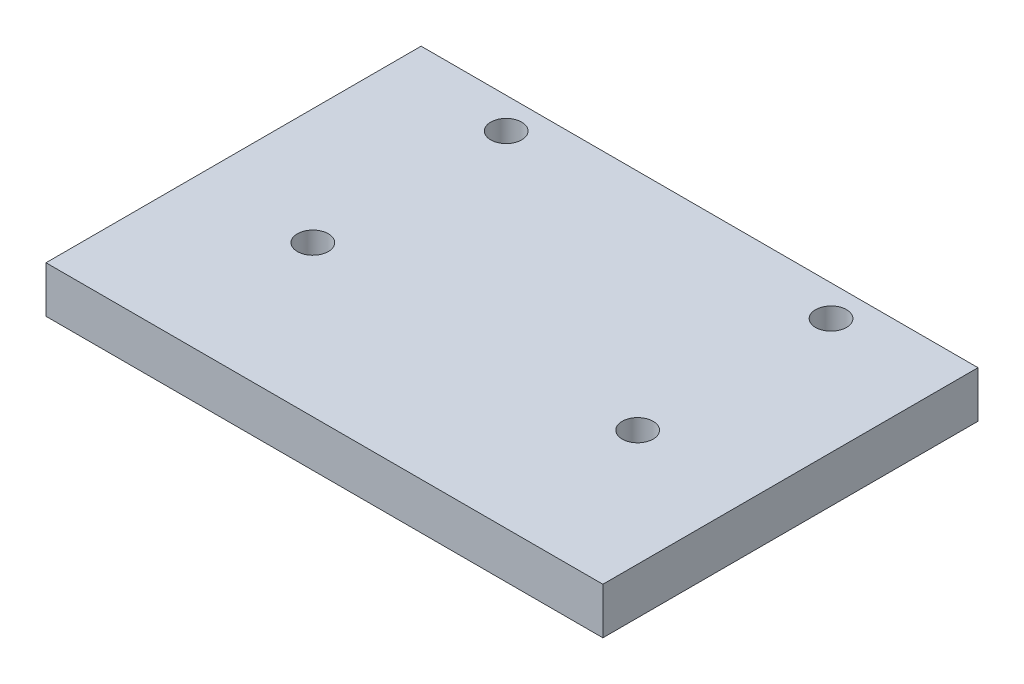
from build123d import *

# Parameters (mm, degrees)
SKETCH2_W           = 36
SKETCH2_H           = 24.25
SKETCH2_R           = 1
BOSS_EXTRUDE1_DEPTH = 3


with BuildPart() as part:
    # Sketch2 → Boss-Extrude1 (new body)
    with BuildSketch(Plane(origin=(0, 0, 0), x_dir=(1, 0, 0), z_dir=(0, 1, 0))):
        with Locations((18, 12.125)):
            Rectangle(SKETCH2_W, SKETCH2_H)
        with Locations(Location((7.5, 22.25, 0), (0, 0, 270))):
            Circle(SKETCH2_R, mode=Mode.SUBTRACT)
        with Locations(Location((28.5, 22.25, 0), (0, 0, 270))):
            Circle(SKETCH2_R, mode=Mode.SUBTRACT)
        with Locations(Location((28.5, 9.75, 0), (0, 0, 270))):
            Circle(SKETCH2_R, mode=Mode.SUBTRACT)
        with Locations(Location((7.5, 9.75, 0), (0, 0, 270))):
            Circle(SKETCH2_R, mode=Mode.SUBTRACT)
    extrude(amount=BOSS_EXTRUDE1_DEPTH)


solid = part.part
